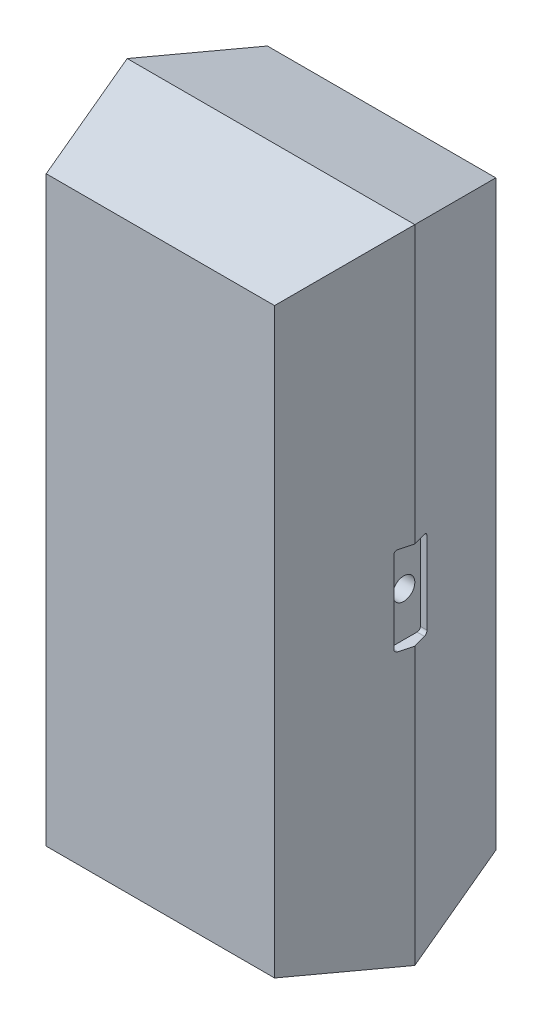
from build123d import *

# Parameters (mm, degrees)
ESBO_O15_W                         = 1.3
ESBO_O15_H                         = 2.9
RESSALTO_EXTRUS_O1_DEPTH           = 0.5
RESSALTO_EXTRUS_O1_TAPER           = 15
RESSALTO_EXTRUS_O1_OTHER_WAY_DEPTH = 0.5
RESSALTO_EXTRUS_O1_OTHER_WAY_TAPER = 15
ESBO_O18_R                         = 0.05
CORTE_EXTRUS_O1_DEPTH              = 1
ESBO_O18_3_R                       = 0.05
CORTE_EXTRUS_O2_DEPTH              = 1
CORTE_EXTRUS_O3_DEPTH              = 0.05
CORTE_EXTRUS_O4_START              = 1.3
CORTE_EXTRUS_O4_DEPTH              = 0.05


with BuildPart() as part:
    # Esboço15 → Ressalto-extrusão1 (new body)
    with BuildSketch(Plane.XY.offset(0.5)):
        Rectangle(ESBO_O15_W, ESBO_O15_H)
    extrude(amount=-RESSALTO_EXTRUS_O1_DEPTH, taper=RESSALTO_EXTRUS_O1_TAPER)

    # Esboço15 → Ressalto-extrusão1 other way (add)
    with BuildSketch(Plane.XY.offset(0.5)):
        Rectangle(ESBO_O15_W, ESBO_O15_H)
    extrude(amount=RESSALTO_EXTRUS_O1_OTHER_WAY_DEPTH, taper=RESSALTO_EXTRUS_O1_OTHER_WAY_TAPER)

    # Esboço18 → Corte-extrusão1 (cut)
    with BuildSketch(Plane(origin=(0, 0, 0), x_dir=(0, 0, -1), z_dir=(1, 0, 0))):
        with Locations((-0.5, 0.95)):
            Circle(ESBO_O18_R)
        with Locations((-0.5, -0.95)):
            Circle(ESBO_O18_R)
    extrude(amount=-CORTE_EXTRUS_O1_DEPTH, mode=Mode.SUBTRACT)

    # Esboço18<3> → Corte-extrusão2 (cut)
    with BuildSketch(Plane(origin=(0, 0, 0), x_dir=(0, 0, -1), z_dir=(1, 0, 0))):
        with Locations(Location((-0.5, 0, 0), (0, 0, 270))):
            Circle(ESBO_O18_3_R)
    extrude(amount=CORTE_EXTRUS_O2_DEPTH, mode=Mode.SUBTRACT)

    # Esboço19 → Corte-extrusão3 (cut)
    with BuildSketch(Plane(origin=(-0.65, 0, 0), x_dir=(0, 0, -1), z_dir=(1, 0, 0))):
        with BuildLine():
            Line((-0.44, 1.15), (-0.56, 1.15))
            ThreePointArc((-0.56, 1.15), (-0.570606602, 1.145606602), (-0.575, 1.135))
            Line((-0.575, 1.135), (-0.575, 0.765))
            ThreePointArc((-0.575, 0.765), (-0.570606602, 0.754393398), (-0.56, 0.75))
            Line((-0.56, 0.75), (-0.44, 0.75))
            ThreePointArc((-0.44, 0.75), (-0.429393398, 0.754393398), (-0.425, 0.765))
            Line((-0.425, 0.765), (-0.425, 1.135))
            ThreePointArc((-0.425, 1.135), (-0.429393398, 1.145606602), (-0.44, 1.15))
        make_face()
        with BuildLine():
            Line((-0.44, -0.75), (-0.56, -0.75))
            ThreePointArc((-0.56, -0.75), (-0.570606602, -0.754393398), (-0.575, -0.765))
            Line((-0.575, -0.765), (-0.575, -1.135))
            ThreePointArc((-0.575, -1.135), (-0.570606602, -1.145606602), (-0.56, -1.15))
            Line((-0.56, -1.15), (-0.44, -1.15))
            ThreePointArc((-0.44, -1.15), (-0.429393398, -1.145606602), (-0.425, -1.135))
            Line((-0.425, -1.135), (-0.425, -0.765))
            ThreePointArc((-0.425, -0.765), (-0.429393398, -0.754393398), (-0.44, -0.75))
        make_face()
    extrude(amount=CORTE_EXTRUS_O3_DEPTH, mode=Mode.SUBTRACT)

    # Esboço19<3> → Corte-extrusão4 (cut)
    with BuildSketch(Plane(origin=(-0.65, 0, 0), x_dir=(0, 0, -1), z_dir=(1, 0, 0)).offset(CORTE_EXTRUS_O4_START)):
        with BuildLine():
            Line((-0.44, 0.2), (-0.56, 0.2))
            ThreePointArc((-0.56, 0.2), (-0.570606602, 0.195606602), (-0.575, 0.185))
            Line((-0.575, 0.185), (-0.575, -0.185))
            ThreePointArc((-0.575, -0.185), (-0.570606602, -0.195606602), (-0.56, -0.2))
            Line((-0.56, -0.2), (-0.44, -0.2))
            ThreePointArc((-0.44, -0.2), (-0.429393398, -0.195606602), (-0.425, -0.185))
            Line((-0.425, -0.185), (-0.425, 0.185))
            ThreePointArc((-0.425, 0.185), (-0.429393398, 0.195606602), (-0.44, 0.2))
        make_face()
    extrude(amount=-CORTE_EXTRUS_O4_DEPTH, mode=Mode.SUBTRACT)


solid = part.part
